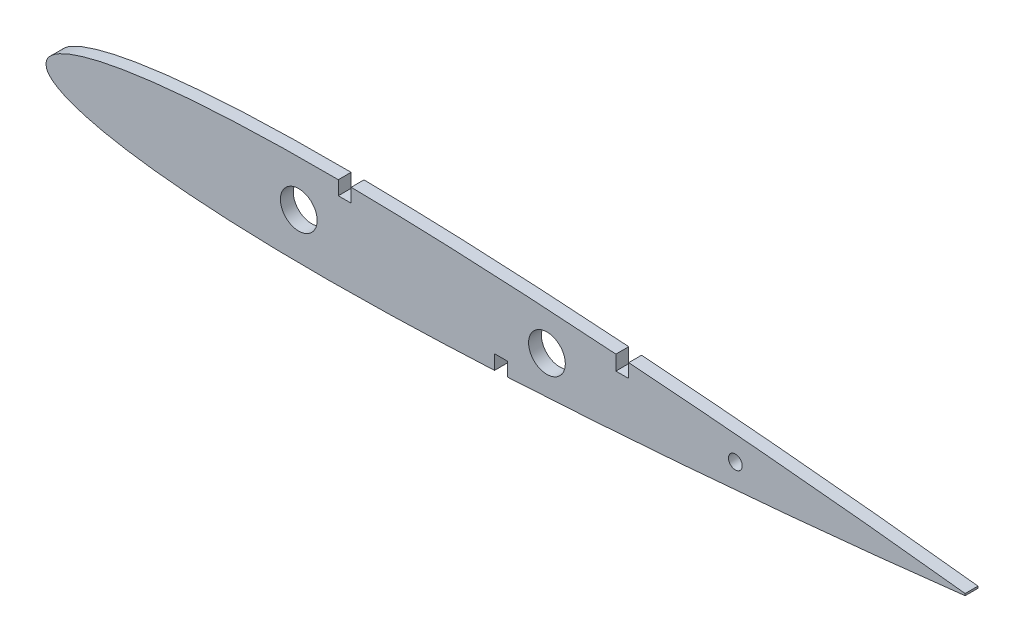
from build123d import *

# Parameters (mm, degrees)
SKETCH_3_R      = 4
SKETCH_3_R_2    = 1.5
EXTRUDE_1_DEPTH = 1.4


with BuildPart() as part:
    # Эскиз3 → Бобышка-Вытянуть1 (new, symmetric)
    # profile 1 of 3: a face of its own
    with BuildSketch(Plane.XY):
        with BuildLine():
            ThreePointArc((142.832679674, -5.874542072), (140.732814602, 0), (142.832679674, 5.874542072))
            add(Edge.make_bspline(
                [(142.832679674, 5.874542072), (142.738367078, 5.882342313), (140.704418314, 6.050397669), (136.716836604, 6.372892076), (131.466708661, 6.779317653), (128.156255998, 7.025385403), (126.8, 7.124412105)],
                knots=[0.283155863, 0.283155863, 0.283155863, 0.283155863, 0.284555151, 0.313332763, 0.342309554, 0.362416837, 0.362416837, 0.362416837, 0.362416837], degree=3))
            Line((126.8, 7.124412105), (126.8, 4.124412105))
            Line((126.8, 4.124412105), (124, 4.124412105))
            Line((124, 4.124412105), (124, 7.326294797))
            add(Edge.make_bspline(
                [(124, 7.326294797), (122.364596134, 7.442700413), (118.769611386, 7.692718614), (113.223109349, 8.057497647), (107.374551667, 8.416266925), (101.566628903, 8.744829808), (95.813307617, 9.040711105), (90.127882502, 9.301433286), (84.52309051, 9.524657051), (79.011121778, 9.708185508), (73.603706202, 9.849984193), (69.41154014, 9.927778606), (67.023185068, 9.958531818), (66.4, 9.965595937)],
                knots=[0.376253135, 0.376253135, 0.376253135, 0.376253135, 0.400495752, 0.429537687, 0.458441906, 0.487136113, 0.515551917, 0.543623846, 0.571289984, 0.59849081, 0.625169613, 0.651272029, 0.660487149, 0.660487149, 0.660487149, 0.660487149], degree=3))
            Line((66.4, 9.965595937), (66.4, 6.965595937))
            Line((66.4, 6.965595937), (63.6, 6.965595937))
            Line((63.6, 6.965595937), (63.6, 9.990751447))
            add(Edge.make_bspline(
                [(63.599999999, 9.990751447), (63.433767139, 9.991846739), (61.590618822, 10.003190391), (58.119580475, 10.007674079), (53.239340889, 9.96650448), (48.51637403, 9.877065972), (43.960263434, 9.738807032), (39.580313292, 9.551735955), (35.385580653, 9.316092874), (31.384869897, 9.032475932), (27.586779877, 8.701741845), (23.999672572, 8.325205071), (20.631718928, 7.904294519), (17.490877441, 7.44078362), (14.58489291, 6.936612431), (11.921305119, 6.393879384), (9.507426038, 5.81478546), (7.350195056, 5.201638101), (5.45639967, 4.556541724), (3.831515725, 3.88154028), (2.48215991, 3.178007515), (1.407454518, 2.445359098), (0.62379252, 1.678905598), (0.100633198, 0.863800259), (0.032444913, 0.278495812), (0, 0)],
                knots=[0.674288155, 0.674288155, 0.674288155, 0.674288155, 0.676746158, 0.701541791, 0.725611017, 0.748907835, 0.771387785, 0.793008139, 0.813728033, 0.833507815, 0.852309696, 0.87009731, 0.886835918, 0.902492782, 0.917037139, 0.930441054, 0.942679762, 0.953733567, 0.963589785, 0.972247019, 0.979722225, 0.986065145, 0.991385258, 0.995900989, 1, 1, 1, 1], degree=3))
            add(Edge.make_bspline(
                [(0, 0), (0.032444913, -0.278495812), (0.100633198, -0.863800259), (0.62379252, -1.678905598), (1.407454518, -2.445359098), (2.48215991, -3.178007515), (3.831515725, -3.88154028), (5.45639967, -4.556541724), (7.350195056, -5.201638101), (9.507426038, -5.81478546), (11.921305119, -6.393879384), (14.58489291, -6.936612431), (17.490877441, -7.44078362), (20.631718928, -7.904294519), (23.999672572, -8.325205071), (27.586779877, -8.701741845), (31.384869897, -9.032475932), (35.385580653, -9.316092874), (39.580313292, -9.551735955), (43.960263434, -9.738807032), (48.51637403, -9.877065972), (53.239340889, -9.96650448), (58.119580475, -10.007674079), (63.147232299, -10.001179647), (68.312112852, -9.948180779), (73.603706202, -9.849984193), (79.011121778, -9.708185508), (84.52309051, -9.524657051), (90.127882502, -9.301433286), (94.497039971, -9.101072496), (96.996632606, -8.97732649), (97.6, -8.946938935)],
                knots=[0, 0, 0, 0, 0.004099011, 0.008614742, 0.013934855, 0.020277775, 0.027752981, 0.036410215, 0.046266433, 0.057320238, 0.069558946, 0.082962861, 0.097507218, 0.113164082, 0.12990269, 0.147690304, 0.166492185, 0.186271967, 0.206991861, 0.228612215, 0.251092165, 0.274388983, 0.298458209, 0.323253842, 0.348727971, 0.374830387, 0.40150919, 0.428710016, 0.456376154, 0.484448083, 0.493380908, 0.493380908, 0.493380908, 0.493380908], degree=3))
            Line((97.6, -8.946938935), (97.6, -5.802264))
            Line((97.6, -5.802264), (100.4, -5.802264))
            Line((100.4, -5.802264), (100.4, -8.802264))
            add(Edge.make_bspline(
                [(100.4, -8.802264), (100.782530515, -8.78200637), (103.102887785, -8.657921344), (107.374551667, -8.416266925), (113.223109349, -8.057497647), (119.097620698, -7.671146294), (124.98256269, -7.259840679), (130.861479372, -6.826169971), (136.716836604, -6.372892076), (140.704418314, -6.050397669), (142.738367078, -5.882342313), (142.832679674, -5.874542072)],
                knots=[0.507199784, 0.507199784, 0.507199784, 0.507199784, 0.512863887, 0.541558094, 0.570462313, 0.599504248, 0.628607349, 0.657690446, 0.686667237, 0.715444849, 0.716844137, 0.716844137, 0.716844137, 0.716844137], degree=3))
        make_face()
        with Locations((55, 0)):
            Circle(SKETCH_3_R, mode=Mode.SUBTRACT)
        with Locations((109, 0)):
            Circle(SKETCH_3_R, mode=Mode.SUBTRACT)
    # profile 2 of 3: a face of its own
    with BuildSketch(Plane.XY):
        with BuildLine():
            ThreePointArc((150, -5.267185398), (144.732814602, 0), (150, 5.267185398))
            add(Edge.make_bspline(
                [(150, 5.267185398), (149.435842895, 5.316128425), (147.047047026, 5.522238119), (144.657842763, 5.723589679), (142.832679674, 5.874542072)],
                knots=[0.247703369, 0.247703369, 0.247703369, 0.247703369, 0.256076454, 0.283155863, 0.283155863, 0.283155863, 0.283155863], degree=3))
            ThreePointArc((142.832679674, 5.874542072), (140.732814602, 0), (142.832679674, -5.874542072))
            add(Edge.make_bspline(
                [(142.832679674, -5.874542072), (144.657842763, -5.723589679), (147.047047026, -5.522238119), (149.435842895, -5.316128425), (150, -5.267185398)],
                knots=[0.716844137, 0.716844137, 0.716844137, 0.716844137, 0.743923546, 0.752296631, 0.752296631, 0.752296631, 0.752296631], degree=3))
        make_face()
    # profile 3 of 3: a face of its own
    with BuildSketch(Plane.XY):
        with BuildLine():
            Line((200, -0.21), (200, 0.21))
            add(Edge.make_bspline(
                [(200, 0.21), (199.520051416, 0.265971644), (198.179524953, 0.422303954), (195.747560944, 0.701689979), (192.530784687, 1.065063842), (188.771568451, 1.480695182), (184.58704572, 1.932479181), (180.05616868, 2.409243063), (175.238405485, 2.90257428), (168.371896377, 3.585728287), (161.260104983, 4.261418012), (154.510064634, 4.872380257), (151.327214442, 5.152043902), (150, 5.267185398)],
                knots=[0, 0, 0, 0, 0.007144724, 0.019955661, 0.036196061, 0.055011184, 0.075878938, 0.098428866, 0.122375554, 0.147487885, 0.200459747, 0.22800517, 0.247703369, 0.247703369, 0.247703369, 0.247703369], degree=3))
            ThreePointArc((150, 5.267185398), (144.732814602, 0), (150, -5.267185398))
            add(Edge.make_bspline(
                [(150, -5.267185398), (151.327214442, -5.152043902), (154.510064634, -4.872380257), (161.260104983, -4.261418012), (168.371896377, -3.585728287), (175.238405485, -2.90257428), (180.05616868, -2.409243063), (184.58704572, -1.932479181), (188.771568451, -1.480695182), (192.530784687, -1.065063842), (195.747560944, -0.701689979), (198.179524953, -0.422303954), (199.520051416, -0.265971644), (200, -0.21)],
                knots=[0.752296631, 0.752296631, 0.752296631, 0.752296631, 0.77199483, 0.799540253, 0.852512115, 0.877624446, 0.901571134, 0.924121062, 0.944988816, 0.963803939, 0.980044339, 0.992855276, 1, 1, 1, 1], degree=3))
        make_face()
        with Locations((150, 0)):
            Circle(SKETCH_3_R_2, mode=Mode.SUBTRACT)
    extrude(amount=EXTRUDE_1_DEPTH, both=True)


solid = part.part
